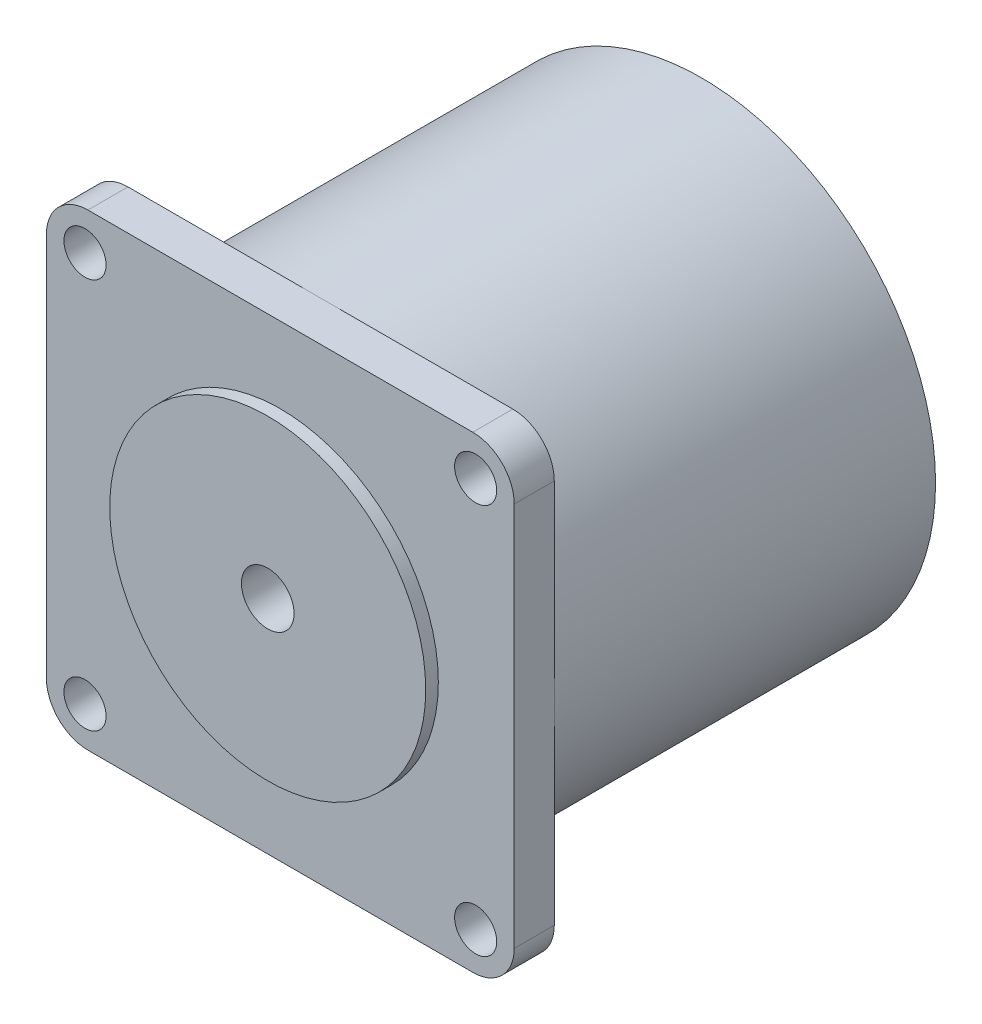
from build123d import *

# Parameters (mm, degrees)
ESQUISSE1_R                     = 28.2
BASE_EXTRUSION_DEPTH            = 45.97
BOSS_EXTRU_1_DEPTH              = 4.83
ESQUISSE3_R                     = 19.05
BOSS_EXTRU_2_DEPTH              = 1.52
ESQUISSE4_R                     = 2.54
ENL_V_MAT_EXTRU_1_DEPTH         = 65.584208596
ESQUISSE5_R                     = 3.175
ENL_V_MAT_EXTRU_2_DEPTH         = 30
R_P_TITION_LIN_AIRE1_COUNT      = 2
R_P_TITION_LIN_AIRE1_PITCH      = 47.1
R_P_TITION_LIN_AIRE1_COUNT_DIR2 = 2
R_P_TITION_LIN_AIRE1_PITCH_DIR2 = 47.1


with BuildPart() as part:
    # Esquisse1 → Base-Extrusion (new body)
    with BuildSketch(Plane.XY):
        Circle(ESQUISSE1_R)
    extrude(amount=BASE_EXTRUSION_DEPTH)

    # Esquisse2 → Boss.-Extru.1 (add)
    with BuildSketch(Plane.XY.offset(45.97)):
        with BuildLine():
            Line((-23.2, 28.2), (23.2, 28.2))
            ThreePointArc((23.2, 28.2), (26.735533906, 26.735533906), (28.2, 23.2))
            Line((28.2, 23.2), (28.2, -23.2))
            ThreePointArc((28.2, -23.2), (26.735533906, -26.735533906), (23.2, -28.2))
            Line((23.2, -28.2), (-23.2, -28.2))
            ThreePointArc((-23.2, -28.2), (-26.735533906, -26.735533906), (-28.2, -23.2))
            Line((-28.2, -23.2), (-28.2, 23.2))
            ThreePointArc((-28.2, 23.2), (-26.735533906, 26.735533906), (-23.2, 28.2))
        make_face()
    extrude(amount=BOSS_EXTRU_1_DEPTH)

    # Esquisse3 → Boss.-Extru.2 (add)
    with BuildSketch(Plane.XY.offset(50.8)):
        Circle(ESQUISSE3_R)
    extrude(amount=BOSS_EXTRU_2_DEPTH)

    # Esquisse4 → Enlèv. mat.-Extru.1 (cut, through all)
    with BuildSketch(Plane.XY.offset(50.8)):
        with Locations((-23.55, 23.55)):
            Circle(ESQUISSE4_R)
    enl_v_mat_extru_1 = extrude(amount=-ENL_V_MAT_EXTRU_1_DEPTH, mode=Mode.SUBTRACT)

    # Esquisse5 → Enlèv. mat.-Extru.2 (cut)
    with BuildSketch(Plane.XY.offset(52.32)):
        Circle(ESQUISSE5_R)
    extrude(amount=-ENL_V_MAT_EXTRU_2_DEPTH, mode=Mode.SUBTRACT)

    # Répétition linéaire1: Enl_v. mat.-Extru.1 2 × 2
    with Locations(*[(i * R_P_TITION_LIN_AIRE1_PITCH, -j * R_P_TITION_LIN_AIRE1_PITCH_DIR2, 0) for i in range(R_P_TITION_LIN_AIRE1_COUNT) for j in range(R_P_TITION_LIN_AIRE1_COUNT_DIR2) if (i, j) != (0, 0)]):
        add(enl_v_mat_extru_1, mode=Mode.SUBTRACT)


solid = part.part
